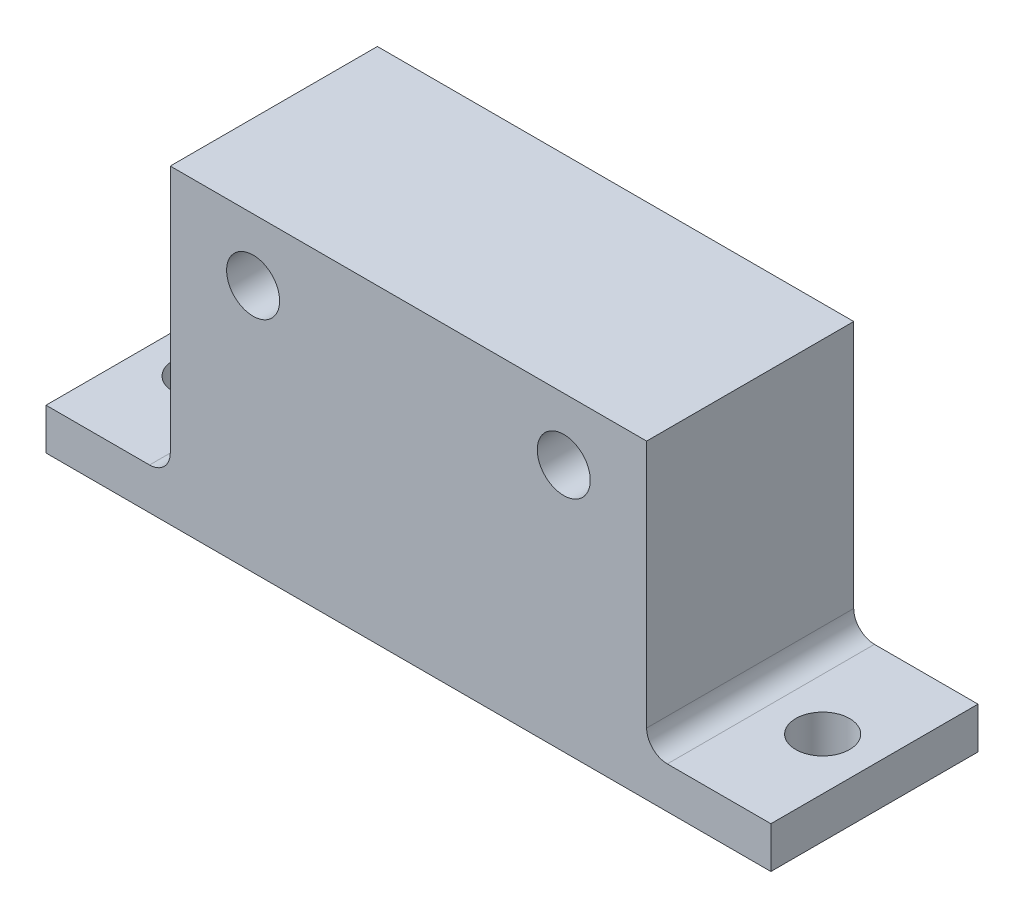
from build123d import *

# Parameters (mm, degrees)
SKETCH1_W           = 44.45
SKETCH1_H           = 19.05
BOSS_EXTRUDE1_DEPTH = 12.7
SKETCH2_W           = 7.62
SKETCH2_H           = 16.51
CUT_EXTRUDE1_DEPTH  = 12.7
FILLET1_R           = 1.27
FILLET2_R           = 1.27
SKETCH3_R           = 1.6256
CUT_EXTRUDE2_DEPTH  = 12.7
SKETCH4_R           = 1.651
CUT_EXTRUDE3_DEPTH  = 12.7


with BuildPart() as part:
    # Sketch1 → Boss-Extrude1 (new body)
    with BuildSketch(Plane.XY):
        Rectangle(SKETCH1_W, SKETCH1_H)
    extrude(amount=BOSS_EXTRUDE1_DEPTH)

    # Sketch2 → Cut-Extrude1 (cut)
    with BuildSketch(Plane.XY.offset(12.7)):
        with Locations((-18.415, 1.27)):
            Rectangle(SKETCH2_W, SKETCH2_H)
        with Locations((18.415, 1.27)):
            Rectangle(SKETCH2_W, SKETCH2_H)
    extrude(amount=-CUT_EXTRUDE1_DEPTH, mode=Mode.SUBTRACT)

    # Fillet1
    fillet1_edges = [part.edges().sort_by_distance(p)[0] for p in [
        (-14.605, -6.985, 6.35),
    ]]
    fillet(fillet1_edges, radius=FILLET1_R)

    # Fillet2
    fillet2_edges = [part.edges().sort_by_distance(p)[0] for p in [
        (14.605, -6.985, 6.35),
    ]]
    fillet(fillet2_edges, radius=FILLET2_R)

    # Sketch3 → Cut-Extrude2 (cut)
    with BuildSketch(Plane(origin=(0, 0, 0), x_dir=(-1, 0, 0), z_dir=(0, 0, -1))):
        with Locations((-9.525, 5.715)):
            Circle(SKETCH3_R)
        with Locations((9.525, 5.715)):
            Circle(SKETCH3_R)
    extrude(amount=-CUT_EXTRUDE2_DEPTH, mode=Mode.SUBTRACT)

    # Sketch4 → Cut-Extrude3 (cut)
    with BuildSketch(Plane(origin=(0, -6.985, 0), x_dir=(1, 0, 0), z_dir=(0, 1, 0))):
        with Locations(Location((19.05, -6.35, 0), (0, 0, 180))):
            Circle(SKETCH4_R)
        with Locations(Location((-19.05, -6.4262, 0), (0, 0, 180))):
            Circle(SKETCH4_R)
    extrude(amount=-CUT_EXTRUDE3_DEPTH, mode=Mode.SUBTRACT)


solid = part.part
